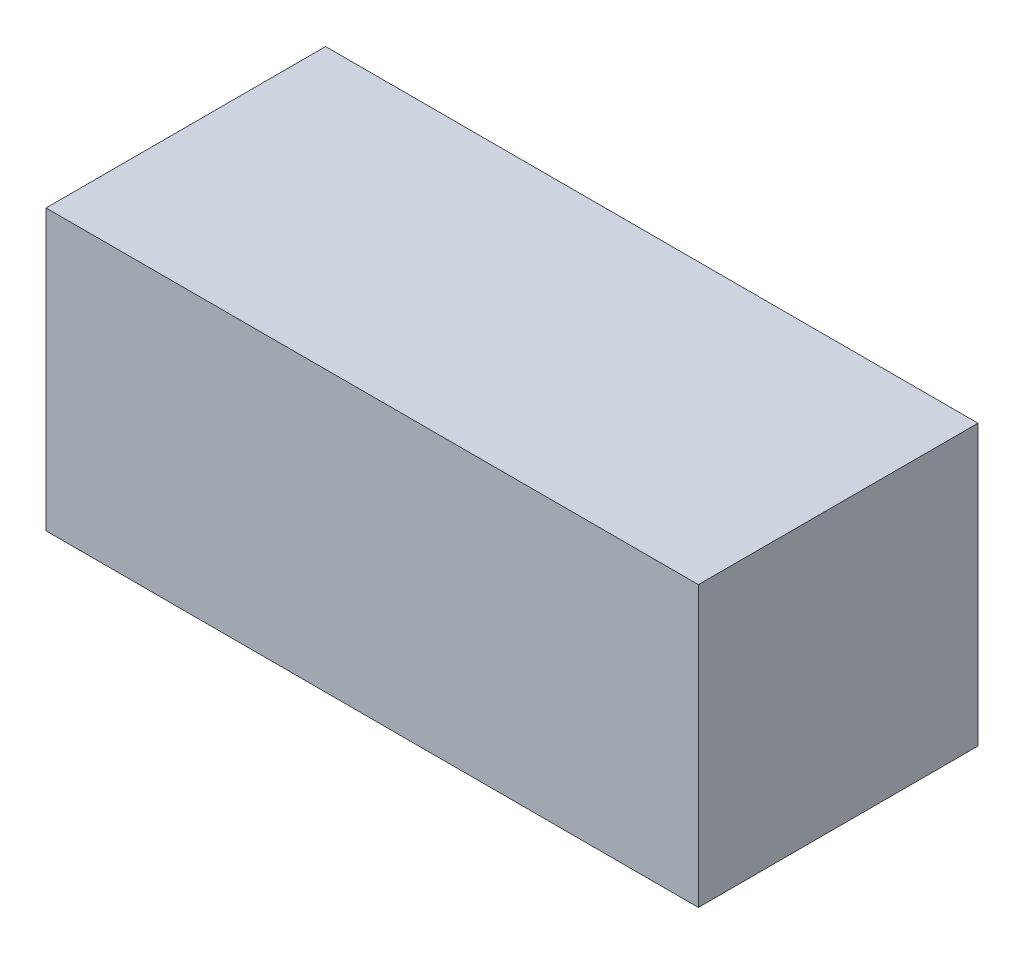
from build123d import *

# Parameters (mm, degrees)
SKETCH1_W           = 38.1
SKETCH1_H           = 38.1
BOSS_EXTRUDE1_DEPTH = 88.9


with BuildPart() as part:
    # Sketch1 → Boss-Extrude1 (new body)
    with BuildSketch(Plane(origin=(0, 0, 0), x_dir=(0, 0, -1), z_dir=(1, 0, 0))):
        with Locations((19.05, 19.05)):
            Rectangle(SKETCH1_W, SKETCH1_H)
    extrude(amount=BOSS_EXTRUDE1_DEPTH)


solid = part.part
